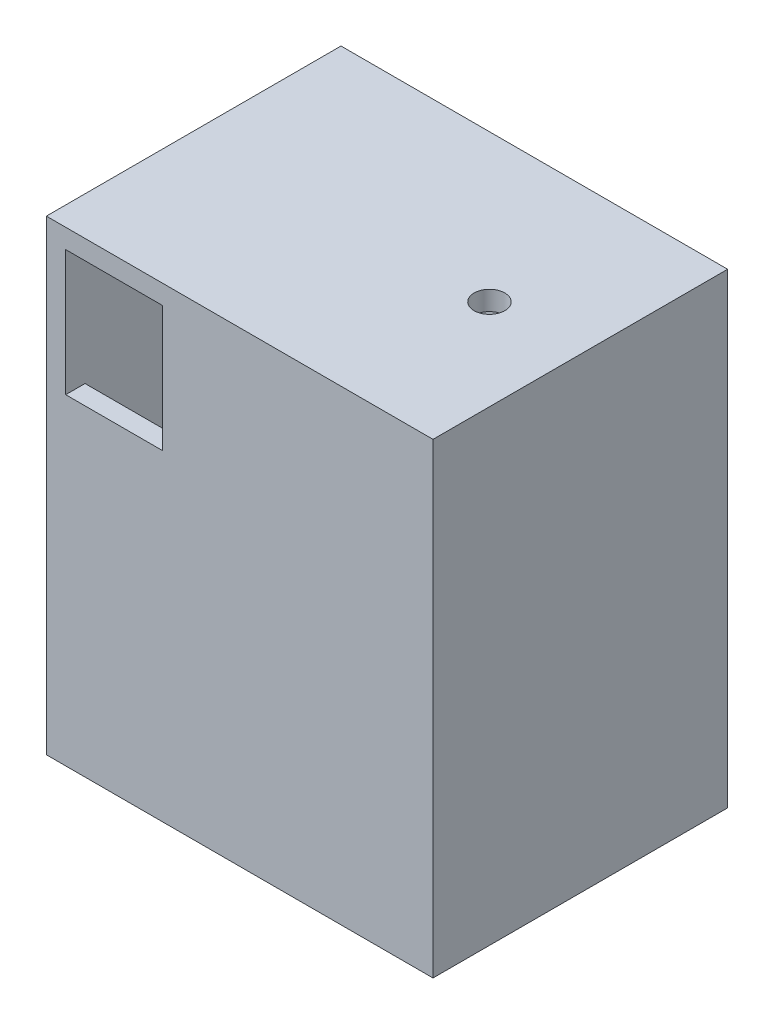
from build123d import *

# Parameters (mm, degrees)
SKETCH1_W           = 400
SKETCH1_H           = 304.8
BOSS_EXTRUDE1_DEPTH = 482.6
SHELL1_T            = 20
CUT_EXTRUDE1_REACH  = 546.177
SKETCH2_R           = 15.904700308
SKETCH3_W           = 100
SKETCH3_H           = 130
CUT_EXTRUDE2_DEPTH  = 50
SKETCH4_W           = 60
SKETCH4_H           = 80
CUT_EXTRUDE3_DEPTH  = 30


with BuildPart() as part:
    # Sketch1 → Boss-Extrude1 (new body)
    with BuildSketch(Plane(origin=(0, 0, 0), x_dir=(1, 0, 0), z_dir=(0, 1, 0))):
        Rectangle(SKETCH1_W, SKETCH1_H)
    extrude(amount=BOSS_EXTRUDE1_DEPTH)

    # Shell1 (no face opened: a closed hollow body)
    add(offset(amount=-SHELL1_T, mode=Mode.PRIVATE), mode=Mode.SUBTRACT)

    # Sketch2 → Cut-Extrude1 (cut, up to next)
    with BuildSketch(Plane(origin=(0, 482.6, 0), x_dir=(1, 0, 0), z_dir=(0, 1, 0)), mode=Mode.PRIVATE) as cut_extrude1_sk1:
        with Locations(Location((106, 0, 0), (0, 0, 270))):
            Circle(SKETCH2_R)
    cut_extrude1_tool1 = extrude(cut_extrude1_sk1.sketch, amount=-CUT_EXTRUDE1_REACH, mode=Mode.PRIVATE) & part.part
    add(cut_extrude1_tool1.solids().sort_by_distance((106, 482.6, 0))[0], mode=Mode.SUBTRACT)

    # Sketch3 → Cut-Extrude2 (cut)
    with BuildSketch(Plane.XY.offset(152.4)):
        with Locations((-130, 397.6)):
            Rectangle(SKETCH3_W, SKETCH3_H)
    extrude(amount=-CUT_EXTRUDE2_DEPTH, mode=Mode.SUBTRACT)

    # Sketch4 → Cut-Extrude3 (cut)
    with BuildSketch(Plane.XZ):
        with Locations((-60, 0)):
            Rectangle(SKETCH4_W, SKETCH4_H)
    extrude(amount=-CUT_EXTRUDE3_DEPTH, mode=Mode.SUBTRACT)


solid = part.part
